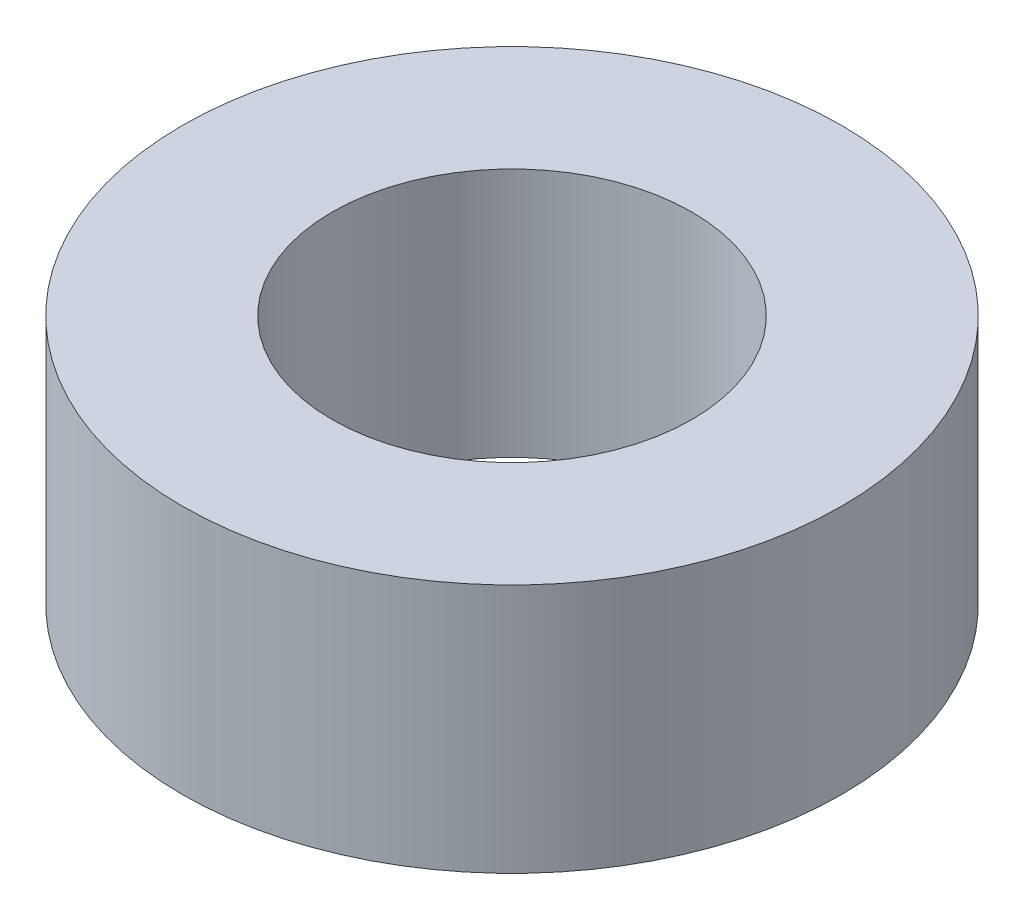
from build123d import *

# Parameters (mm, degrees)
SKETCH1_R           = 3.3
SKETCH1_R_2         = 1.8
BOSS_EXTRUDE1_DEPTH = 2.5


with BuildPart() as part:
    # Sketch1 → Boss-Extrude1 (new body)
    with BuildSketch(Plane(origin=(0, 0, 0), x_dir=(1, 0, 0), z_dir=(0, 1, 0))):
        with Locations(Location((0, 0, 0), (0, 0, 270))):
            Circle(SKETCH1_R)
        with Locations(Location((0, 0, 0), (0, 0, 270))):
            Circle(SKETCH1_R_2, mode=Mode.SUBTRACT)
    extrude(amount=BOSS_EXTRUDE1_DEPTH)


solid = part.part
